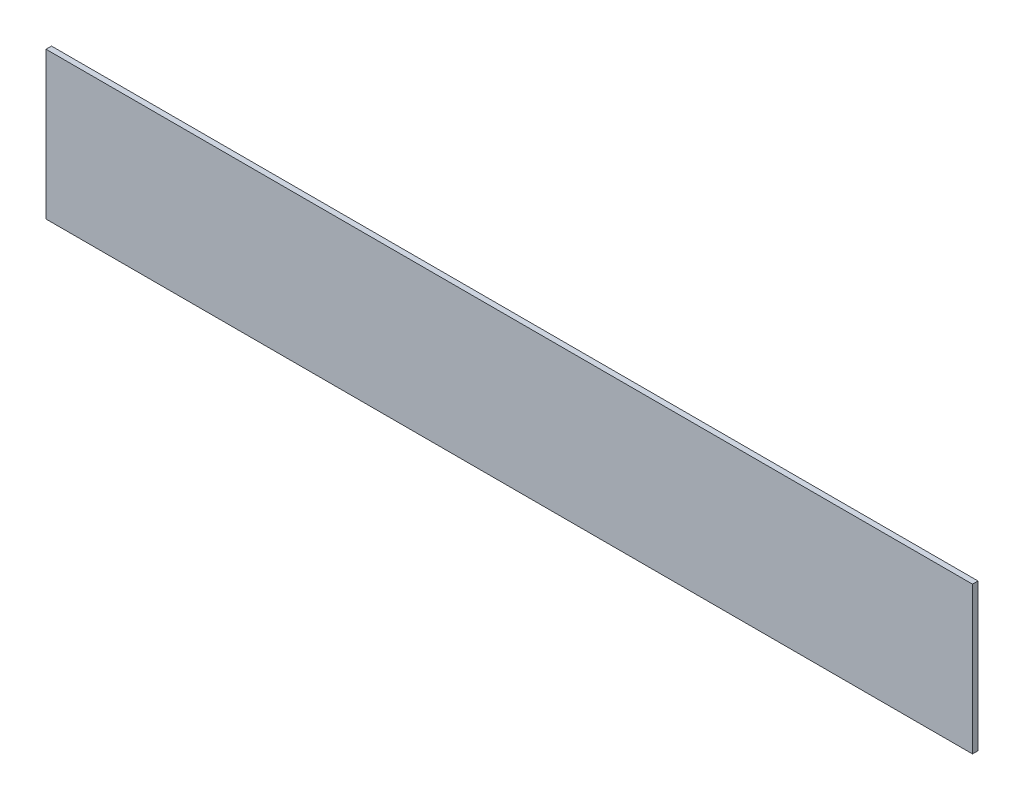
from build123d import *

# Parameters (mm, degrees)
SKICA1_W                = 504
SKICA1_H                = 80
P_IDAT_VYSUNUT_M1_DEPTH = 3


with BuildPart() as part:
    # Skica1 → Přidat vysunutím1 (new body)
    with BuildSketch(Plane.XY):
        Rectangle(SKICA1_W, SKICA1_H)
    extrude(amount=P_IDAT_VYSUNUT_M1_DEPTH)


solid = part.part
